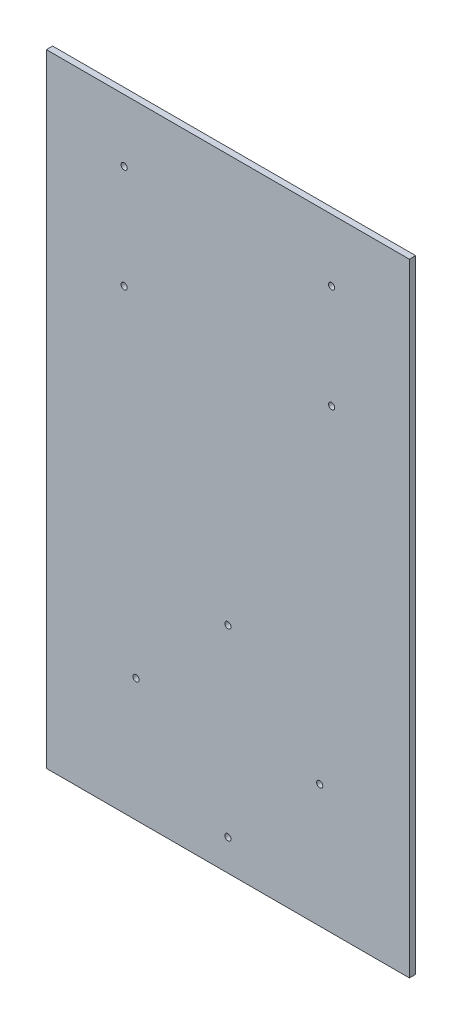
from build123d import *

# Parameters (mm, degrees)
SKETCH_1_W          = 175
SKETCH_1_H          = 300
EXTRUDE_1_DEPTH     = 3
SKETCH_2_R          = 1.5
CUT_EXTRUDE_1_DEPTH = 3
SKETCH_3_R          = 1.5
CUT_EXTRUDE_2_DEPTH = 3


with BuildPart() as part:
    # 草图1 → 凸台-拉伸1 (new body)
    with BuildSketch(Plane.XY):
        Rectangle(SKETCH_1_W, SKETCH_1_H)
    extrude(amount=EXTRUDE_1_DEPTH)

    # 草图2 → 切除-拉伸1 (cut)
    with BuildSketch(Plane.XY.offset(3)):
        with Locations((0, -135)):
            Circle(SKETCH_2_R)
        with Locations((-44.25, -90.75)):
            Circle(SKETCH_2_R)
        with Locations((0, -46.5)):
            Circle(SKETCH_2_R)
        with Locations((44.25, -90.75)):
            Circle(SKETCH_2_R)
    extrude(amount=-CUT_EXTRUDE_1_DEPTH, mode=Mode.SUBTRACT)

    # 草图3 → 切除-拉伸2 (cut)
    with BuildSketch(Plane.XY.offset(3)):
        with Locations((50, 70)):
            Circle(SKETCH_3_R)
        with Locations((50, 120)):
            Circle(SKETCH_3_R)
        with Locations((-50, 120)):
            Circle(SKETCH_3_R)
        with Locations((-50, 70)):
            Circle(SKETCH_3_R)
    extrude(amount=-CUT_EXTRUDE_2_DEPTH, mode=Mode.SUBTRACT)


solid = part.part
